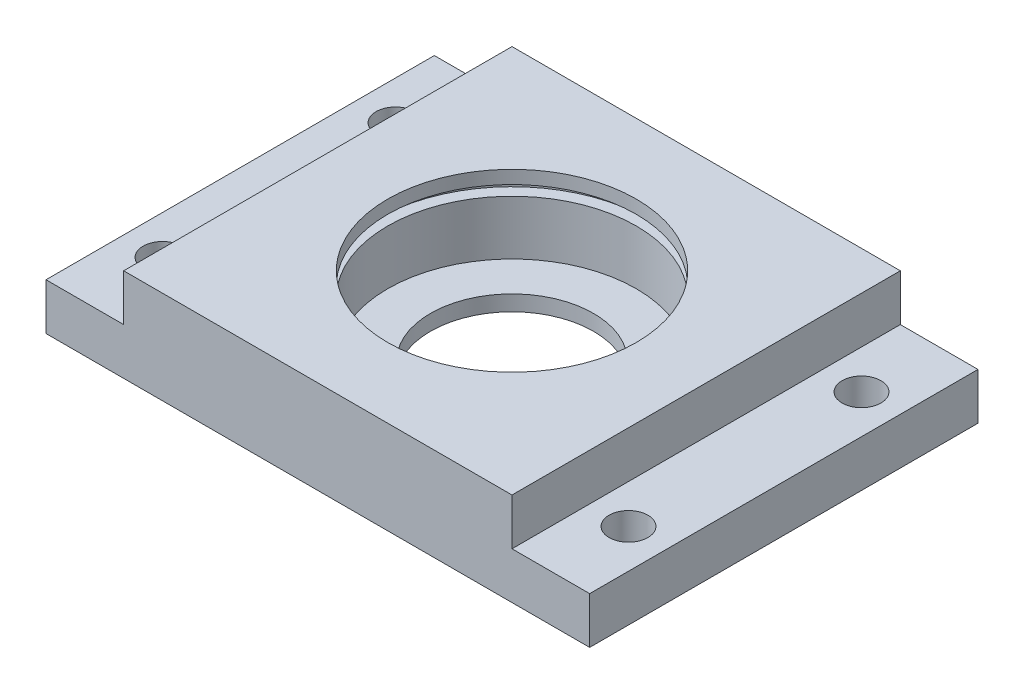
from build123d import *

# Parameters (mm, degrees)
SKETCH1_W           = 50
SKETCH1_H           = 50
BOSS_EXTRUDE2_DEPTH = 12
SKETCH3_R           = 16
CUT_EXTRUDE1_DEPTH  = 10
SKETCH6_R           = 10.5
CUT_EXTRUDE2_DEPTH  = 10
SKETCH9_W           = 50
SKETCH9_H           = 6
BOSS_EXTRUDE3_DEPTH = 10
SKETCH11_W          = 50
SKETCH11_H          = 6
BOSS_EXTRUDE4_DEPTH = 10
SKETCH12_R          = 2.5
CUT_EXTRUDE4_DEPTH  = 10


with BuildPart() as part:
    # Sketch1 → Boss-Extrude2 (new body)
    with BuildSketch(Plane(origin=(0, 0, 0), x_dir=(1, 0, 0), z_dir=(0, 1, 0))):
        Rectangle(SKETCH1_W, SKETCH1_H)
    extrude(amount=BOSS_EXTRUDE2_DEPTH)

    # Sketch3 → Cut-Extrude1 (cut)
    with BuildSketch(Plane(origin=(0, 12, 0), x_dir=(1, 0, 0), z_dir=(0, 1, 0))):
        with Locations(Location((0, 0, 0), (0, 0, 270))):
            Circle(SKETCH3_R)
    extrude(amount=-CUT_EXTRUDE1_DEPTH, mode=Mode.SUBTRACT)

    # Sketch5 → Cut-Revolve1 (revolve, cut)
    with BuildSketch(Plane.XY, mode=Mode.PRIVATE) as cut_revolve1_sk:
        Polygon((-16, 9), (-17.5, 9), (-17.5, 10.3), (-16, 10.3), (-15.747172999, 10.3), (-15.747172999, 9), align=None)
    revolve(cut_revolve1_sk.sketch.rotate(Axis((0, 2, 0), (0, 1, 0)), 90), axis=Axis((0, 2, 0), (0, 1, 0)), mode=Mode.SUBTRACT)

    # Sketch6 → Cut-Extrude2 (cut)
    with BuildSketch(Plane(origin=(0, 2, 0), x_dir=(1, 0, 0), z_dir=(0, 1, 0))):
        with Locations(Location((0, 0, 0), (0, 0, 270))):
            Circle(SKETCH6_R)
    extrude(amount=-CUT_EXTRUDE2_DEPTH, mode=Mode.SUBTRACT)

    # Sketch9 → Boss-Extrude3 (add)
    with BuildSketch(Plane.ZY.offset(25)):
        with Locations((0, 3)):
            Rectangle(SKETCH9_W, SKETCH9_H)
    extrude(amount=BOSS_EXTRUDE3_DEPTH)

    # Sketch11 → Boss-Extrude4 (add)
    with BuildSketch(Plane(origin=(25, 0, 0), x_dir=(0, 0, -1), z_dir=(1, 0, 0))):
        with Locations((0, 3)):
            Rectangle(SKETCH11_W, SKETCH11_H)
    extrude(amount=BOSS_EXTRUDE4_DEPTH)

    # Sketch12 → Cut-Extrude4 (cut)
    with BuildSketch(Plane(origin=(0, 6, 0), x_dir=(1, 0, 0), z_dir=(0, 1, 0))):
        with Locations(Location((-30, 15, 0), (0, 0, 270))):
            Circle(SKETCH12_R)
        with Locations(Location((-30, -15, 0), (0, 0, 90))):
            Circle(SKETCH12_R)
        with Locations(Location((30, -15, 0), (0, 0, 270))):
            Circle(SKETCH12_R)
        with Locations(Location((30, 15, 0), (0, 0, 90))):
            Circle(SKETCH12_R)
    extrude(amount=-CUT_EXTRUDE4_DEPTH, mode=Mode.SUBTRACT)


solid = part.part
